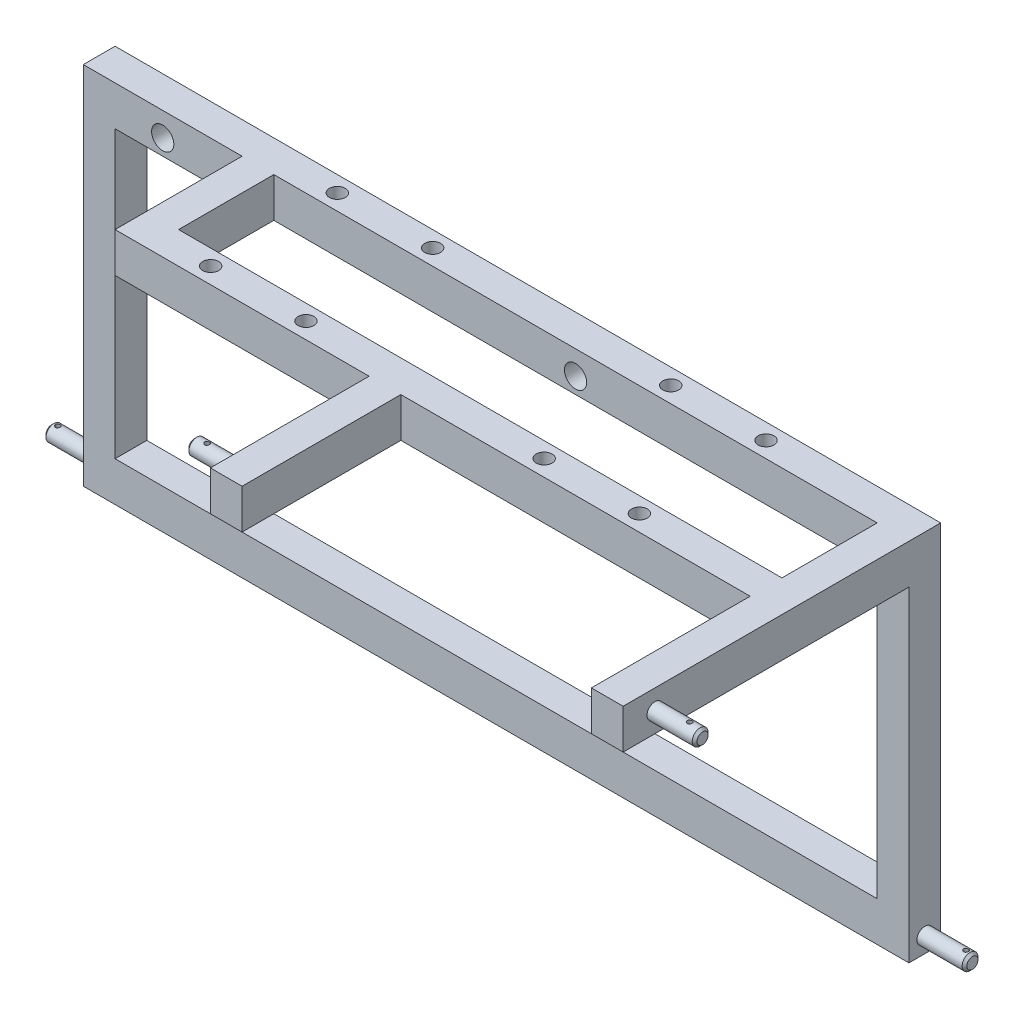
from build123d import *

# Parameters (mm, degrees)
IZIM1_W                     = 260
IZIM1_H                     = 115
IZIM1_W_2                   = 240
IZIM1_H_2                   = 90
Y_KSEKLIK_EKSTR_ZYON1_DEPTH = 10
Y_KSEKLIK_EKSTR_ZYON2_START = -12.5
Y_KSEKLIK_EKSTR_ZYON2_DEPTH = 12.5
IZIM3_W                     = 10
IZIM3_H                     = 12.5
Y_KSEKLIK_EKSTR_ZYON3_DEPTH = 50
IZIM4_R                     = 2.5
Y_KSEKLIK_EKSTR_ZYON4_DEPTH = 15
IZIM5_R                     = 0.75
KES_EKSTR_ZYON1_DEPTH       = 15
PAH1_SIZE                   = 0.75
IZIM6_R                     = 2.5
Y_KSEKLIK_EKSTR_ZYON5_DEPTH = 15
IZIM7_R                     = 0.75
KES_EKSTR_ZYON2_DEPTH       = 15
PAH2_SIZE                   = 0.75
PAH3_SIZE                   = 0.75
IZIM8_R                     = 2.5
KES_EKSTR_ZYON3_DEPTH       = 15
IZIM9_R                     = 3.5
KES_EKSTR_ZYON4_DEPTH       = 15


with BuildPart() as part:
    # Çizim1 → Yükseklik-Ekstrüzyon1 (new body)
    with BuildSketch(Plane.XY):
        with Locations((130, 57.5)):
            Rectangle(IZIM1_W, IZIM1_H)
        with Locations((130, 57.5)):
            Rectangle(IZIM1_W_2, IZIM1_H_2, mode=Mode.SUBTRACT)
    extrude(amount=Y_KSEKLIK_EKSTR_ZYON1_DEPTH)

    # Çizim2 → Yükseklik-Ekstrüzyon2 (add)
    with BuildSketch(Plane(origin=(0, 115, 0), x_dir=(1, 0, 0), z_dir=(0, 1, 0)).offset(Y_KSEKLIK_EKSTR_ZYON2_START)):
        Polygon((260, -10), (260, -50), (50, -50), (50, -10), (60, -10), (60, -40), (250, -40), (250, -10), align=None)
    extrude(amount=Y_KSEKLIK_EKSTR_ZYON2_DEPTH)

    # Çizim3 → Yükseklik-Ekstrüzyon3 (add)
    with BuildSketch(Plane.XY.offset(50)):
        with Locations((255, 108.75)):
            Rectangle(IZIM3_W, IZIM3_H)
        with Locations((135, 108.75)):
            Rectangle(IZIM3_W, IZIM3_H)
    extrude(amount=Y_KSEKLIK_EKSTR_ZYON3_DEPTH)

    # Çizim4 → Yükseklik-Ekstrüzyon4 (add)
    with BuildSketch(Plane(origin=(260, 0, 0), x_dir=(0, 0, -1), z_dir=(1, 0, 0))):
        with Locations(Location((-90, 108.75, 0), (0, 0, 180))):
            Circle(IZIM4_R)
    y_kseklik_ekstr_zyon4 = extrude(amount=Y_KSEKLIK_EKSTR_ZYON4_DEPTH)

    # Çizim5 → Kes-Ekstrüzyon1 (cut)
    with BuildSketch(Plane(origin=(0, 115, 0), x_dir=(1, 0, 0), z_dir=(0, 1, 0))):
        with Locations(Location((271, -90, 0), (0, 0, 270))):
            Circle(IZIM5_R)
    kes_ekstr_zyon1 = extrude(amount=-KES_EKSTR_ZYON1_DEPTH, mode=Mode.SUBTRACT)

    # Aynalama1: Yükseklik-Ekstrüzyon4, Kes-Ekstrüzyon1 across plane
    add(y_kseklik_ekstr_zyon4.mirror(Plane(origin=(195, 0, 0), x_dir=(0, 0, 1), z_dir=(1, 0, 0))))
    add(kes_ekstr_zyon1.mirror(Plane(origin=(195, 0, 0), x_dir=(0, 0, 1), z_dir=(1, 0, 0))), mode=Mode.SUBTRACT)

    # Pah1
    pah1_edges = [part.edges().sort_by_distance(p)[0] for p in [
        (275, 108.75, 87.5),
        (115, 108.75, 87.5),
    ]]
    chamfer(pah1_edges, length=PAH1_SIZE)

    # Çizim6 → Yükseklik-Ekstrüzyon5 (add)
    with BuildSketch(Plane(origin=(260, 0, 0), x_dir=(0, 0, -1), z_dir=(1, 0, 0))):
        with Locations(Location((-5, 5, 0), (0, 0, 180))):
            Circle(IZIM6_R)
    y_kseklik_ekstr_zyon5 = extrude(amount=Y_KSEKLIK_EKSTR_ZYON5_DEPTH)

    # Çizim7 → Kes-Ekstrüzyon2 (cut)
    with BuildSketch(Plane.XZ):
        with Locations(Location((273, 5, 0), (0, 0, 270))):
            Circle(IZIM7_R)
    kes_ekstr_zyon2 = extrude(amount=-KES_EKSTR_ZYON2_DEPTH, mode=Mode.SUBTRACT)

    # Pah2
    pah2_edges = [part.edges().sort_by_distance(p)[0] for p in [
        (275, 5, 2.5),
    ]]
    chamfer(pah2_edges, length=PAH2_SIZE)

    # Aynalama5: Yükseklik-Ekstrüzyon5, Kes-Ekstrüzyon2 across plane
    add(y_kseklik_ekstr_zyon5.mirror(Plane(origin=(130, 0, 0), x_dir=(0, 0, 1), z_dir=(1, 0, 0))))
    add(kes_ekstr_zyon2.mirror(Plane(origin=(130, 0, 0), x_dir=(0, 0, 1), z_dir=(1, 0, 0))), mode=Mode.SUBTRACT)

    # Pah3
    pah3_edges = [part.edges().sort_by_distance(p)[0] for p in [
        (-15, 5, 2.5),
    ]]
    chamfer(pah3_edges, length=PAH3_SIZE)

    # Çizim8 → Kes-Ekstrüzyon3 (cut)
    with BuildSketch(Plane(origin=(0, 115, 0), x_dir=(1, 0, 0), z_dir=(0, 1, 0))):
        with Locations(Location((210, -5, 0), (0, 0, 270))):
            Circle(IZIM8_R)
        with Locations(Location((180, -5, 0), (0, 0, 270))):
            Circle(IZIM8_R)
        with Locations(Location((105, -5, 0), (0, 0, 270))):
            Circle(IZIM8_R)
        with Locations(Location((75, -5, 0), (0, 0, 270))):
            Circle(IZIM8_R)
        with Locations(Location((75, -44.884971075, 0), (0, 0, 270))):
            Circle(IZIM8_R)
        with Locations(Location((105, -44.884971075, 0), (0, 0, 270))):
            Circle(IZIM8_R)
        with Locations(Location((180, -44.884971075, 0), (0, 0, 270))):
            Circle(IZIM8_R)
        with Locations(Location((210, -44.884971075, 0), (0, 0, 270))):
            Circle(IZIM8_R)
    extrude(amount=-KES_EKSTR_ZYON3_DEPTH, mode=Mode.SUBTRACT)

    # Çizim9 → Kes-Ekstrüzyon4 (cut)
    with BuildSketch(Plane.XY.offset(10)):
        with Locations((155, 107.5)):
            Circle(IZIM9_R)
        with Locations((25, 107.5)):
            Circle(IZIM9_R)
    extrude(amount=-KES_EKSTR_ZYON4_DEPTH, mode=Mode.SUBTRACT)


solid = part.part
